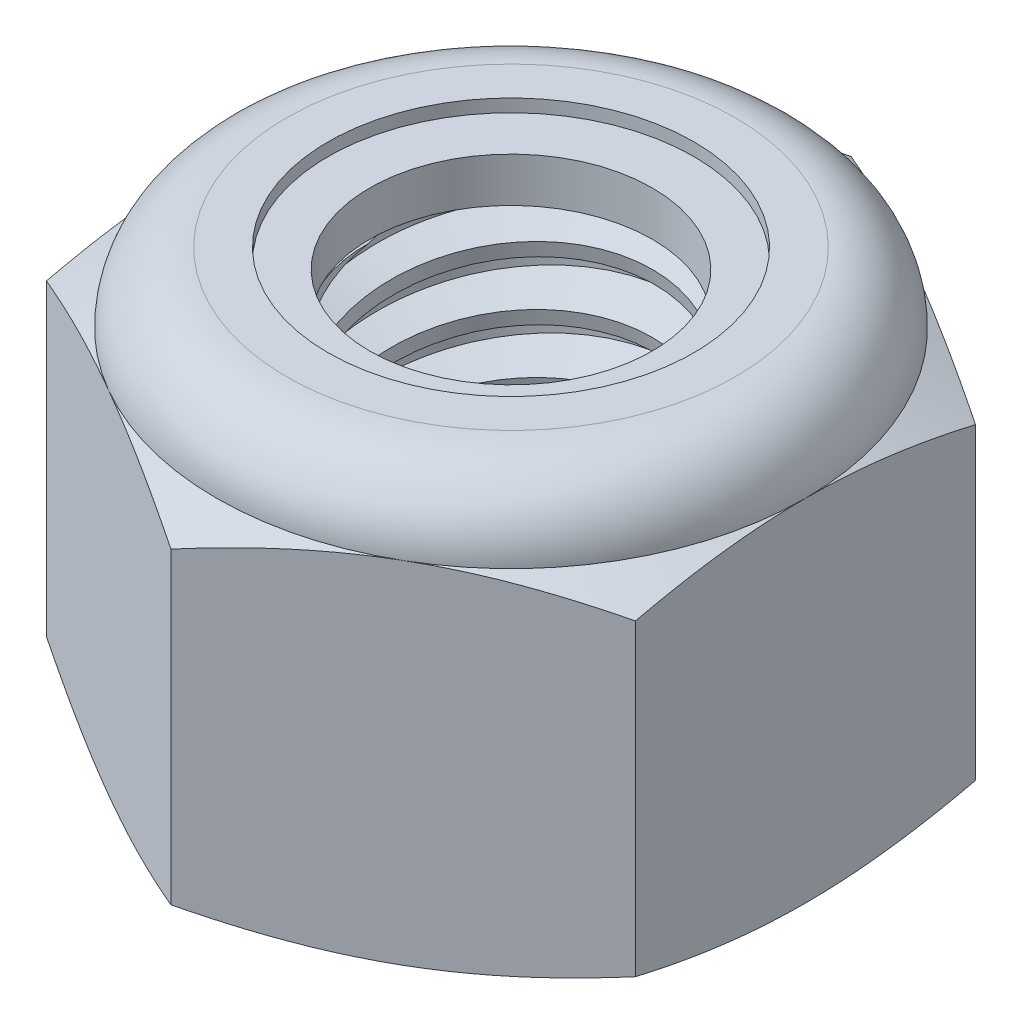
from build123d import *

# Parameters (mm, degrees)
EXTRUDE1_DEPTH      = 5
SKETCH2_W           = 2
SKETCH2_H           = 5
LPATTERN1_COUNT     = 7
LPATTERN1_PITCH     = 0.7
LPATTERN1_COL_COUNT = 2
LPATTERN1_COL_PITCH = 0.7


with BuildPart() as part:
    # Sketch1 → Extrude1 (new body)
    with BuildSketch(Plane(origin=(0, 0, 0), x_dir=(1, 0, 0), z_dir=(0, 1, 0))):
        Polygon((0, 4.041451884), (-3.5, 2.020725942), (-3.5, -2.020725942), (0, -4.041451884), (3.5, -2.020725942), (3.5, 2.020725942), align=None)
    extrude(amount=EXTRUDE1_DEPTH)

    # Sketch4 → Cut-Revolve2 (revolve, cut)
    with BuildSketch(Plane(origin=(0, 0, 0), x_dir=(0, 0, -1), z_dir=(1, 0, 0)), mode=Mode.PRIVATE) as cut_revolve2_sk:
        Polygon((0, 5), (2, 5), (1.679577111, 4.850584353), (1.679577111, 0.149415647), (2, 0), (0, 0), align=None)
    revolve(cut_revolve2_sk.sketch.rotate(Axis((0, 5, 0), (0, 1, 0)), 54.612382926), axis=Axis((0, 5, 0), (0, 1, 0)), mode=Mode.SUBTRACT)


with BuildPart() as body_2:
    # Sketch2 → Revolve1 (revolve)
    with BuildSketch(Plane(origin=(0, 0, 0), x_dir=(0, 0, -1), z_dir=(1, 0, 0))):
        with Locations((1, 2.5)):
            Rectangle(SKETCH2_W, SKETCH2_H)
    revolve(axis=Axis((0, -2, 0), (0, 1, 0)))

    # Sketch3 → Cut-Revolve1 (revolve, cut)
    with BuildSketch(Plane(origin=(0, 0, 0), x_dir=(0, 0, -1), z_dir=(1, 0, 0)), mode=Mode.PRIVATE) as cut_revolve1_sk:
        Polygon((2.015083279, 4.913809834), (2.120666232, 4.310478673), (1.709743669, 4.460641574), (1.679577111, 4.633021905), align=None)
    cut_revolve1 = revolve(cut_revolve1_sk.sketch.rotate(Axis((0, 5, 0.13120342), (0, -0.9850304671557041, -0.17238033175224876)), 180), axis=Axis((0, 5, 0.13120342), (0, -0.9850304671557041, -0.17238033175224876)), mode=Mode.SUBTRACT)

    # LPattern1: Cut-Revolve1 ×7
    with Locations(*[(0, -i * LPATTERN1_PITCH, 0) for i in range(1, LPATTERN1_COUNT)]):
        add(cut_revolve1, mode=Mode.SUBTRACT)

    # LPattern1 col: Cut-Revolve1 ×2
    with Locations(*[(0, i * LPATTERN1_COL_PITCH, 0) for i in range(1, LPATTERN1_COL_COUNT)]):
        add(cut_revolve1, mode=Mode.SUBTRACT)


with BuildPart() as part_1:
    add(part.part)

    # Combine1: cut body 2
    add(body_2.part, mode=Mode.SUBTRACT)

    # Sketch5 → Cut-Revolve3 (revolve, cut)
    with BuildSketch(Plane(origin=(0, 0, 0), x_dir=(0, 0, -1), z_dir=(1, 0, 0)), mode=Mode.PRIVATE) as cut_revolve3_sk:
        with BuildLine():
            Line((0, 0), (3.5, 0))
            Line((3.5, 0), (4.041451884, 0.25248316))
            Line((4.041451884, 0.25248316), (4.041451884, 3.914183506))
            Line((4.041451884, 3.914183506), (3.5, 4.166666667))
            ThreePointArc((3.5, 4.166666667), (3.255922318, 4.755922318), (2.666666667, 5))
            Line((2.666666667, 5), (2.666666667, 6.27))
            Line((2.666666667, 6.27), (5.311451884, 6.27))
            Line((5.311451884, 6.27), (5.311451884, -1.27))
            Line((5.311451884, -1.27), (0, -1.27))
            Line((0, -1.27), (0, 0))
        make_face()
    revolve(cut_revolve3_sk.sketch.rotate(Axis((0, 0, 0), (0, 1, 0)), 54.612382926), axis=Axis((0, 0, 0), (0, 1, 0)), mode=Mode.SUBTRACT)

    # Sketch6 → Cut-Revolve4 (revolve, cut)
    with BuildSketch(Plane(origin=(0, 0, 0), x_dir=(0, 0, -1), z_dir=(1, 0, 0)), mode=Mode.PRIVATE) as cut_revolve4_sk:
        with BuildLine():
            Line((0, 4.166666667), (3.3476, 4.166666667))
            ThreePointArc((3.3476, 4.166666667), (3.148159244, 4.648159244), (2.666666667, 4.8476))
            Line((2.666666667, 4.8476), (2.173121889, 4.8476))
            Line((2.173121889, 4.8476), (2.173121889, 6.27))
            Line((2.173121889, 6.27), (0, 6.27))
            Line((0, 6.27), (0, 4.166666667))
        make_face()
    revolve(cut_revolve4_sk.sketch.rotate(Axis((0, 6.27, 0), (0, 1, 0)), 54.612382926), axis=Axis((0, 6.27, 0), (0, 1, 0)), mode=Mode.SUBTRACT)


with BuildPart() as body_2_2:
    # Sketch7 → Revolve2 (revolve)
    with BuildSketch(Plane(origin=(0, 0, 0), x_dir=(0, 0, -1), z_dir=(1, 0, 0))):
        with BuildLine():
            Line((1.679577111, 4.242866667), (3.266579964, 4.242866667))
            ThreePointArc((3.266579964, 4.242866667), (3.066430175, 4.620419399), (2.666666667, 4.7714))
            Line((2.666666667, 4.7714), (1.679577111, 4.7714))
            Line((1.679577111, 4.7714), (1.679577111, 4.242866667))
        make_face()
    revolve(axis=Axis((0, 4.242866667, 0), (0, 1, 0)))


solid = Compound([part_1.part, body_2_2.part])
